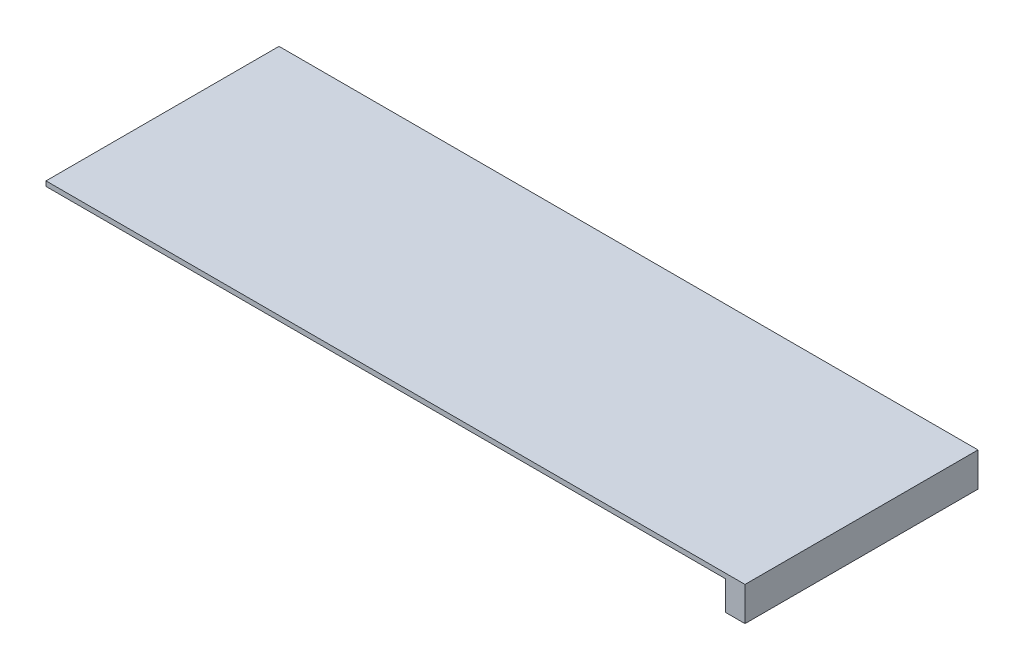
from build123d import *

# Parameters (mm, degrees)
BOSS_EXTRUDE1_DEPTH = 19.05
SKETCH2_R           = 3.96875
CUT_EXTRUDE1_DEPTH  = 19.05
SKETCH3_W           = 457.2
SKETCH3_H           = 152.4
BOSS_EXTRUDE3_DEPTH = 19.05
SKETCH4_W           = 457.2
SKETCH4_H           = 152.4
CUT_EXTRUDE2_DEPTH  = 25.4
CUT_EXTRUDE4_DEPTH  = 25.4
SKETCH6_W           = 457.2
SKETCH6_H           = 152.4
BOSS_EXTRUDE4_DEPTH = 3.175


with BuildPart() as part:
    # Sketch1 → Boss-Extrude1 (new body)
    with BuildSketch(Plane(origin=(0, 0, 0), x_dir=(1, 0, 0), z_dir=(0, 1, 0))):
        Polygon((57.15, 19.05), (0, 19.05), (0, 0), (66.037825848, 0), (97.808358016, 38.1), (336.311308439, 38.1), (400.965853894, -12.7), (431.8, -12.7), (342.9, 57.15), (88.9, 57.15), align=None)
    extrude(amount=BOSS_EXTRUDE1_DEPTH)

    # Sketch2 → Cut-Extrude1 (cut)
    with BuildSketch(Plane.XY):
        with Locations((8.89, 9.525)):
            Circle(SKETCH2_R)
        with Locations((56.515, 9.525)):
            Circle(SKETCH2_R)
    extrude(amount=-CUT_EXTRUDE1_DEPTH, mode=Mode.SUBTRACT)

    # Sketch4 → Cut-Extrude2 (cut)
    with BuildSketch(Plane(origin=(0, 0, 0), x_dir=(1, 0, 0), z_dir=(0, 1, 0))):
        with Locations((215.9, 38.1)):
            Rectangle(SKETCH4_W, SKETCH4_H)
    extrude(amount=CUT_EXTRUDE2_DEPTH, mode=Mode.SUBTRACT)


with BuildPart() as body_2:
    # Sketch3 → Boss-Extrude3 (new body)
    with BuildSketch(Plane.XZ):
        with Locations((215.9, -38.1)):
            Rectangle(SKETCH3_W, SKETCH3_H)
        Polygon((400.965853894, 12.7), (431.8, 12.7), (342.9, -57.15), (88.9, -57.15), (57.15, -19.05), (0, -19.05), (0, 0), (66.037825848, 0), (97.808358016, -38.1), (336.311308439, -38.1), align=None, mode=Mode.SUBTRACT)
    extrude(amount=BOSS_EXTRUDE3_DEPTH)

    # Sketch5 → Cut-Extrude4 (cut)
    with BuildSketch(Plane.XZ.offset(19.05)):
        Polygon((-12.7, -19.05), (0, -19.05), (0, 0), (66.037825848, 0), (97.808358016, -38.1), (336.311308439, -38.1), (400.965853894, 12.7), (431.8, 12.7), (431.8, 38.1), (-12.7, 38.1), align=None)
    extrude(amount=-CUT_EXTRUDE4_DEPTH, mode=Mode.SUBTRACT)

    # Sketch6 → Boss-Extrude4 (add)
    with BuildSketch(Plane(origin=(0, 0, 0), x_dir=(1, 0, 0), z_dir=(0, 1, 0))):
        with Locations((215.9, 38.1)):
            Rectangle(SKETCH6_W, SKETCH6_H)
    extrude(amount=BOSS_EXTRUDE4_DEPTH)


solid = body_2.part
